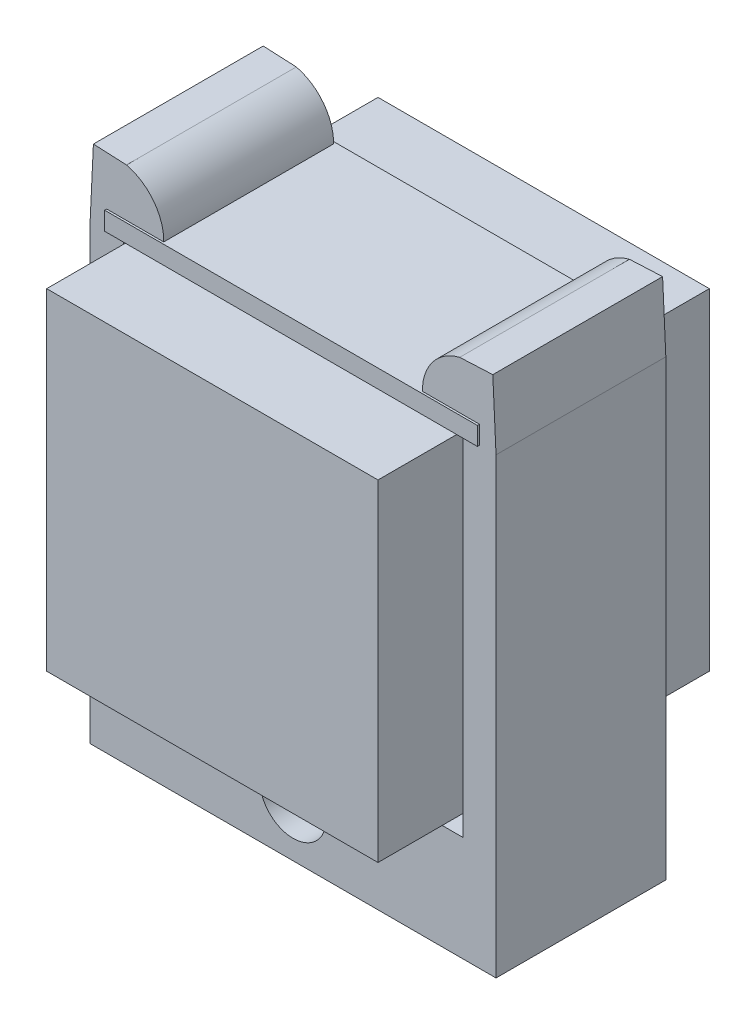
from build123d import *

# Parameters (mm, degrees)
SKETCH1_W                            = 45
SKETCH1_H                            = 21
BOSS_EXTRUDE1_DEPTH                  = 2.2
SKETCH2_W                            = 40
SKETCH2_H                            = 40
BOSS_EXTRUDE2_DEPTH                  = 40
SKETCH3_W                            = 41
SKETCH3_H                            = 12.7
SKETCH3_R                            = 4
SNAPFIT_41MM_SPACING_4MM_WIDTH_DEPTH = 10.25


with BuildPart() as part:
    # Sketch1 → Boss-Extrude1 (new body)
    with BuildSketch(Plane(origin=(0, 0, 0), x_dir=(1, 0, 0), z_dir=(0, 1, 0))):
        Rectangle(SKETCH1_W, SKETCH1_H)
    extrude(amount=BOSS_EXTRUDE1_DEPTH)


with BuildPart() as body_2:
    # Sketch2 → Boss-Extrude2 (new body)
    with BuildSketch(Plane(origin=(0, 0, 0), x_dir=(1, 0, 0), z_dir=(0, 1, 0))):
        Rectangle(SKETCH2_W, SKETCH2_H)
    extrude(amount=-BOSS_EXTRUDE2_DEPTH)


with BuildPart() as body_3:
    # Sketch3 → SnapFit-41mm_spacing-4mm_width (new, symmetric)
    # profile 1 of 3: a face of its own
    with BuildSketch(Plane.XY):
        with Locations((0, -48.35)):
            Rectangle(SKETCH3_W, SKETCH3_H)
        with Locations((0, -48.35)):
            Circle(SKETCH3_R, mode=Mode.SUBTRACT)
    # profile 2 of 3: a face of its own
    with BuildSketch(Plane.XY):
        with BuildLine():
            Line((-24.5, -54.7), (-20.5, -54.7))
            Line((-20.5, -54.7), (-20.5, -42))
            Line((-20.5, -42), (-20.5, 0))
            Line((-20.5, 0), (-20.395356671, 2.197509903))
            Line((-20.395356671, 2.197509903), (-15.614493224, 1.969849739))
            ThreePointArc((-15.614493224, 1.969849739), (-16.78318436, 5.79201944), (-20.114493224, 8.000458132))
            Line((-20.114493224, 8.000458132), (-24.109965775, 8.190718729))
            Line((-24.109965775, 8.190718729), (-24.5, 0))
            Line((-24.5, 0), (-24.5, -54.7))
        make_face()
    # profile 3 of 3: a face of its own
    with BuildSketch(Plane.XY):
        with BuildLine():
            Line((20.5, -42), (20.5, -54.7))
            Line((20.5, -54.7), (24.5, -54.7))
            Line((24.5, -54.7), (24.5, 0))
            Line((24.5, 0), (24.109965775, 8.190718729))
            Line((24.109965775, 8.190718729), (20.114493224, 8.000458132))
            ThreePointArc((20.114493224, 8.000458132), (16.78318436, 5.79201944), (15.614493224, 1.969849739))
            Line((15.614493224, 1.969849739), (20.395356671, 2.197509903))
            Line((20.395356671, 2.197509903), (20.5, 0))
            Line((20.5, 0), (20.5, -42))
        make_face()
    extrude(amount=SNAPFIT_41MM_SPACING_4MM_WIDTH_DEPTH, both=True)


solid = Compound([part.part, body_2.part, body_3.part])
